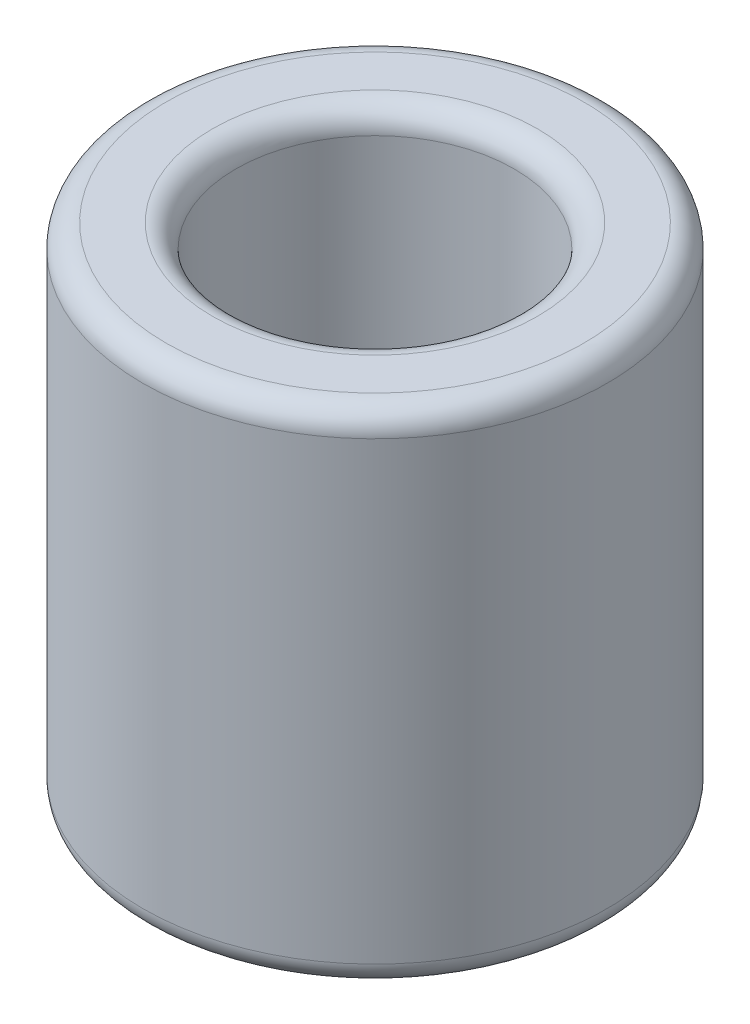
from build123d import *

# Parameters (mm, degrees)
SKETCH1_R           = 2.5
SKETCH1_R_2         = 1.5
BOSS_EXTRUDE1_DEPTH = 5.4
FILLET1_R           = 0.25


with BuildPart() as part:
    # Sketch1 → Boss-Extrude1 (new body)
    with BuildSketch(Plane(origin=(0, 0, 0), x_dir=(1, 0, 0), z_dir=(0, 1, 0))):
        with Locations(Location((0, 0, 0), (0, 0, 90))):
            Circle(SKETCH1_R)
        with Locations(Location((0, 0, 0), (0, 0, 90))):
            Circle(SKETCH1_R_2, mode=Mode.SUBTRACT)
    extrude(amount=BOSS_EXTRUDE1_DEPTH)

    # Fillet1
    fillet1_edges = [part.edges().sort_by_distance(p)[0] for p in [
        (0, 0, 2.5),
        (0, 5.4, 2.5),
        (0, 0, 1.5),
        (0, 5.4, 1.5),
    ]]
    fillet(fillet1_edges, radius=FILLET1_R)


solid = part.part
